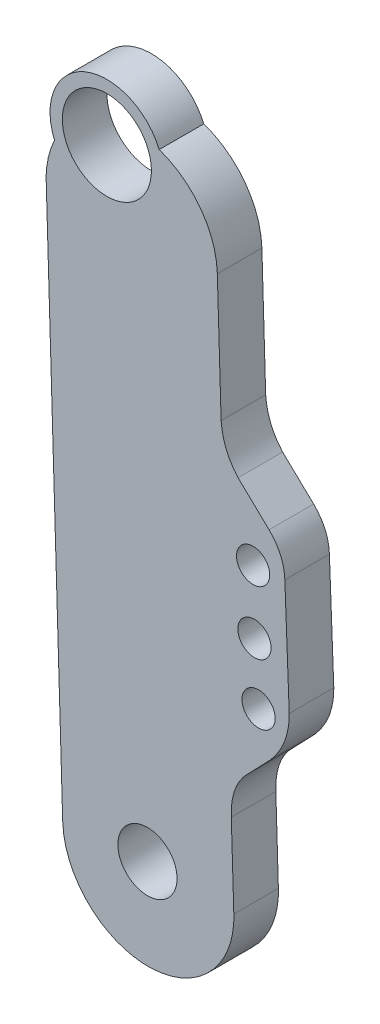
from build123d import *

# Parameters (mm, degrees)
SKETCH1_R           = 3.319499332
SKETCH1_R_2         = 1.86024312
SKETCH1_R_3         = 1.866358203
SKETCH1_R_4         = 1.862576991
SKETCH1_R_5         = 5
BOSS_EXTRUDE1_DEPTH = 5
SCALE1_SCALE        = 1.5


with BuildPart() as part:
    # Sketch1 → Boss-Extrude1 (new body)
    with BuildSketch(Plane.XY):
        with BuildLine():
            Line((-382.519657002, 101.671493886), (-380.669449348, 40.369064063))
            add(Edge.make_bspline(
                [(-380.669449348, 40.369064063), (-380.510075486, 35.088175777), (-376.059011151, 30.897862719), (-370.778076319, 31.057283127)],
                knots=[0.052631579, 0.052631579, 0.052631579, 0.052631579, 0.105263158, 0.105263158, 0.105263158, 0.105263158], degree=3))
            add(Edge.make_bspline(
                [(-370.778076319, 31.057283127), (-365.497188033, 31.216656989), (-361.304408032, 35.667860962), (-361.466295384, 40.948656156)],
                knots=[0.157894737, 0.157894737, 0.157894737, 0.157894737, 0.210526316, 0.210526316, 0.210526316, 0.210526316], degree=3))
            Line((-361.466295384, 40.948656156), (-361.750785175, 50.228506464))
            add(Edge.make_bspline(
                [(-361.750785175, 50.228506464), (-361.835778361, 52.39364506), (-361.180362664, 54.112685792), (-359.833970045, 55.415371618)],
                knots=[0.263157895, 0.263157895, 0.263157895, 0.263157895, 0.315789474, 0.315789474, 0.315789474, 0.315789474], degree=3))
            Line((-359.833970045, 55.415371618), (-357.334397688, 58.013854448))
            add(Edge.make_bspline(
                [(-357.334397688, 58.013854448), (-355.991914942, 59.571473289), (-355.227534814, 61.38849357), (-355.248387468, 63.55777477)],
                knots=[0.368421053, 0.368421053, 0.368421053, 0.368421053, 0.421052632, 0.421052632, 0.421052632, 0.421052632], degree=3))
            Line((-355.248387468, 63.55777477), (-355.740612523, 76.291020209))
            add(Edge.make_bspline(
                [(-355.740612523, 76.291020209), (-355.792418338, 77.812752004), (-356.366704175, 79.147601188), (-357.509736863, 80.278904258)],
                knots=[0.473684211, 0.473684211, 0.473684211, 0.473684211, 0.526315789, 0.526315789, 0.526315789, 0.526315789], degree=3))
            Line((-357.509736863, 80.278904258), (-360.989523636, 83.590706139))
            add(Edge.make_bspline(
                [(-360.989523636, 83.590706139), (-362.20931085, 84.939519155), (-362.761440742, 86.502630437), (-362.89242148, 88.200958152)],
                knots=[0.578947368, 0.578947368, 0.578947368, 0.578947368, 0.631578947, 0.631578947, 0.631578947, 0.631578947], degree=3))
            Line((-362.89242148, 88.200958152), (-363.316503038, 102.251132525))
            add(Edge.make_bspline(
                [(-363.316503038, 102.251132525), (-363.440362222, 106.355428381), (-366.156979065, 109.800631398), (-369.840498136, 111.057283127)],
                knots=[0.684210526, 0.684210526, 0.684210526, 0.684210526, 0.736842105, 0.736842105, 0.736842105, 0.736842105], degree=3))
            ThreePointArc((-369.840498136, 111.057283127), (-378.197199554, 114.445234435), (-381.585150862, 106.088533018))
            add(Edge.make_bspline(
                [(-381.585150862, 106.088533018), (-382.226602728, 104.751635805), (-382.567273667, 103.24866209), (-382.519657002, 101.671493886)],
                knots=[0.894736842, 0.894736842, 0.894736842, 0.894736842, 1, 1, 1, 1], degree=3))
        make_face()
        with Locations((-371.156901577, 41.210904817)):
            Circle(SKETCH1_R, mode=Mode.SUBTRACT)
        with Locations((-359.303466466, 75.91878991)):
            Circle(SKETCH1_R_2, mode=Mode.SUBTRACT)
        with Locations((-359.150100692, 68.896756505)):
            Circle(SKETCH1_R_3, mode=Mode.SUBTRACT)
        with Locations((-358.690863752, 62.277116942)):
            Circle(SKETCH1_R_4, mode=Mode.SUBTRACT)
        with Locations((-375.712824499, 108.572908073)):
            Circle(SKETCH1_R_5, mode=Mode.SUBTRACT)
    extrude(amount=BOSS_EXTRUDE1_DEPTH)


with BuildPart() as part_1:
    # Scale1: scaled about (-370.814087285, 71.044531915, 2.5)
    add(part.part.scale(SCALE1_SCALE).moved(Location((185.407043643, -35.522265957, -1.25))))


solid = part_1.part
